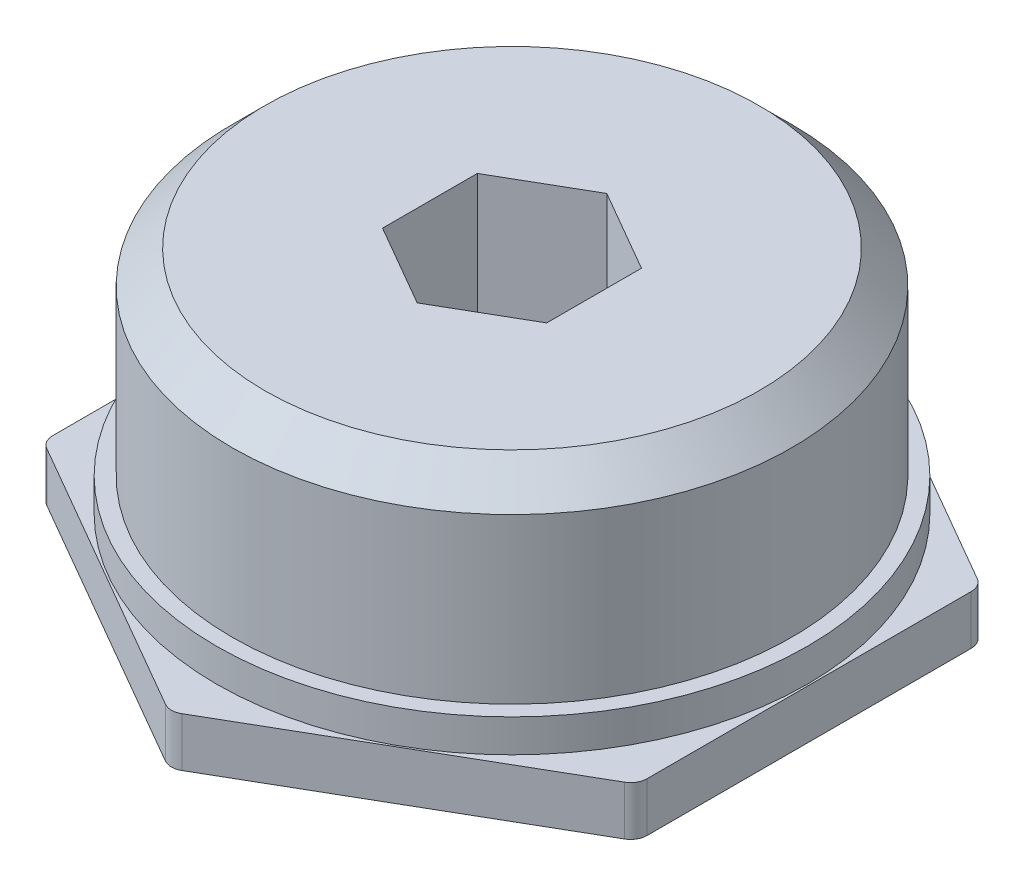
from build123d import *

# Parameters (mm, degrees)
BOSS_EXTRUDE1_DEPTH      = 1.5
FILLET1_R                = 0.5
SKETCH2_R                = 9
BOSS_EXTRUDE2_DEPTH      = 1
SKETCH3_R                = 8.525
BOSS_EXTRUDE3_DEPTH      = 4
BOSS_EXTRUDE4_DEPTH      = 1
BOSS_EXTRUDE4_DEPTH_BACK = 1
SKETCH5_R                = 8.525
SKETCH6_R                = 8.525
BOSS_EXTRUDE5_DEPTH      = 1
CHAMFER2_SIZE            = 1
CUT_EXTRUDE1_DEPTH       = 17.178541022


with BuildPart() as part:
    # Sketch1 → Boss-Extrude1 (new body)
    with BuildSketch(Plane(origin=(0, 31, 0), x_dir=(1, 0, 0), z_dir=(0, 1, 0))):
        Polygon((0, 10.450039872), (-9.05, 5.225019936), (-9.05, -5.225019936), (0, -10.450039872), (9.05, -5.225019936), (9.05, 5.225019936), align=None)
    extrude(amount=BOSS_EXTRUDE1_DEPTH)

    # Fillet1
    fillet1_edges = [part.edges().sort_by_distance(p)[0] for p in [
        (9.05, 31.75, -5.225019936),
        (9.05, 31.75, 5.225019936),
        (0, 31.75, 10.450039872),
        (-9.05, 31.75, 5.225019936),
        (-9.05, 31.75, -5.225019936),
        (0, 31.75, -10.450039872),
    ]]
    fillet(fillet1_edges, radius=FILLET1_R)

    # Sketch2 → Boss-Extrude2 (add)
    with BuildSketch(Plane(origin=(0, 32.5, 0), x_dir=(1, 0, 0), z_dir=(0, 1, 0))):
        with Locations(Location((0, 0, 0), (0, 0, 270))):
            Circle(SKETCH2_R)
    extrude(amount=BOSS_EXTRUDE2_DEPTH)

    # Sketch3 → Boss-Extrude3 (add)
    with BuildSketch(Plane(origin=(0, 33.5, 0), x_dir=(1, 0, 0), z_dir=(0, 1, 0))):
        with Locations(Location((0, 0, 0), (0, 0, 270))):
            Circle(SKETCH3_R)
    extrude(amount=BOSS_EXTRUDE3_DEPTH)

    # Sketch5 → Boss-Extrude4 (add, two sides: drawn at the far end of the back side and taken through both)
    with BuildSketch(Plane(origin=(0, 37.5, 0), x_dir=(1, 0, 0), z_dir=(0, 1, 0)).offset(-BOSS_EXTRUDE4_DEPTH_BACK)):
        with Locations(Location((0, 0, 0), (0, 0, 270))):
            Circle(SKETCH5_R)
    extrude(amount=BOSS_EXTRUDE4_DEPTH + BOSS_EXTRUDE4_DEPTH_BACK)

    # Sketch6 → Boss-Extrude5 (add)
    with BuildSketch(Plane(origin=(0, 38.5, 0), x_dir=(1, 0, 0), z_dir=(0, 1, 0))):
        with Locations(Location((0, 0, 0), (0, 0, 270))):
            Circle(SKETCH6_R)
    extrude(amount=BOSS_EXTRUDE5_DEPTH)

    # Chamfer2
    chamfer2_edges = [part.edges().sort_by_distance(p)[0] for p in [
        (0, 39.5, -8.525),
    ]]
    chamfer(chamfer2_edges, length=CHAMFER2_SIZE)

    # Sketch4 → Cut-Extrude1 (cut, through all)
    with BuildSketch(Plane(origin=(0, 31, 0), x_dir=(1, 0, 0), z_dir=(0, 1, 0))):
        Polygon((0, 2.886751346), (-2.5, 1.443375673), (-2.5, -1.443375673), (0, -2.886751346), (2.5, -1.443375673), (2.5, 1.443375673), align=None)
    extrude(amount=CUT_EXTRUDE1_DEPTH, mode=Mode.SUBTRACT)


solid = part.part
